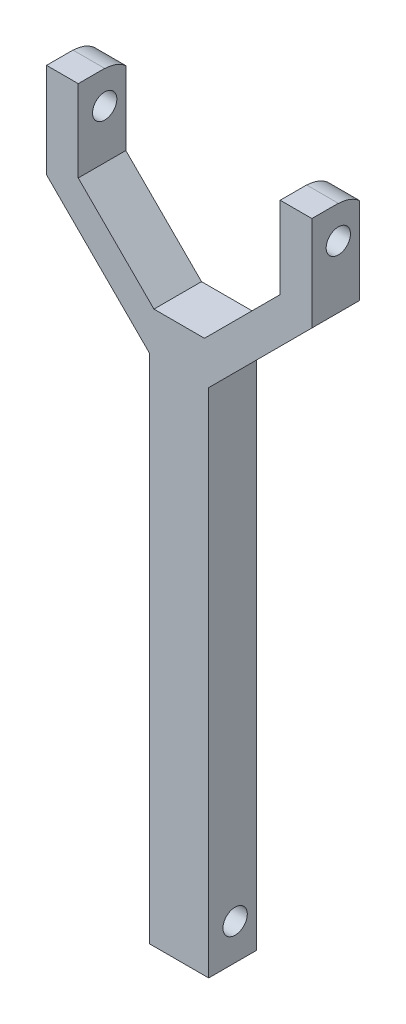
from build123d import *

# Parameters (mm, degrees)
EXTRUDE_1_DEPTH          = 4.5
CUT_EXTRUDE_1_DEPTH      = 100
CUT_EXTRUDE_1_DEPTH_BACK = 100
SKETCH_2_R               = 1.150000595
SKETCH_2_R_2             = 1.150000006
CUT_EXTRUDE_2_DEPTH      = 100
CUT_EXTRUDE_2_DEPTH_BACK = 10


with BuildPart() as part:
    # 草图1 → 凸台-拉伸1 (new body)
    with BuildSketch(Plane.XY):
        Polygon((-3.663147943, -33.4008975), (1.914578421, -33.4008975), (1.914578421, 14.960326674), (11.675714921, 24.721462524), (11.675714921, 33.692325595), (8.675714, 33.692325595), (8.675714, 25.964104178), (1.514824851, 18.803215506), (-3.263396279, 18.803215506), (-10.424284951, 25.964104655), (-10.424284951, 33.692326072), (-13.424284951, 33.692326072), (-13.424284951, 24.721463921), (-3.663147943, 14.960326674), align=None)
    extrude(amount=EXTRUDE_1_DEPTH)

    # 草图2 → 切除-拉伸1 (cut, two sides: drawn at the far end of the back side and taken through both)
    with BuildSketch(Plane(origin=(0, 0, 0), x_dir=(0, 0, -1), z_dir=(1, 0, 0)).offset(-CUT_EXTRUDE_1_DEPTH_BACK)):
        with Locations(Location((-2.000000723, -29.993528863, 0), (0, 0, 180))):
            Circle(SKETCH_2_R)
        with Locations(Location((-2.000000233, 30.610505435, 0), (0, 0, 180))):
            Circle(SKETCH_2_R_2)
    extrude(amount=CUT_EXTRUDE_1_DEPTH + CUT_EXTRUDE_1_DEPTH_BACK, mode=Mode.SUBTRACT)

    # 草图3 → 切除-拉伸2 (cut, two sides: drawn at the far end of the back side and taken through both)
    with BuildSketch(Plane(origin=(-10.424284951, 0, 0), x_dir=(0, 0, -1), z_dir=(1, 0, 0)).offset(-CUT_EXTRUDE_2_DEPTH_BACK)):
        with BuildLine():
            Line((-2.000000233, 33.665271008), (-2.000000233, 37.690968831))
            ThreePointArc((-2.000000233, 37.690968831), (3.006643449, 35.617149116), (5.080463163, 30.610505435))
            Line((5.080463163, 30.610505435), (1.05476534, 30.610505435))
            ThreePointArc((1.05476534, 30.610505435), (0.160045219, 32.770550887), (-2.000000233, 33.665271008))
        make_face()
    extrude(amount=CUT_EXTRUDE_2_DEPTH + CUT_EXTRUDE_2_DEPTH_BACK, mode=Mode.SUBTRACT)


solid = part.part
